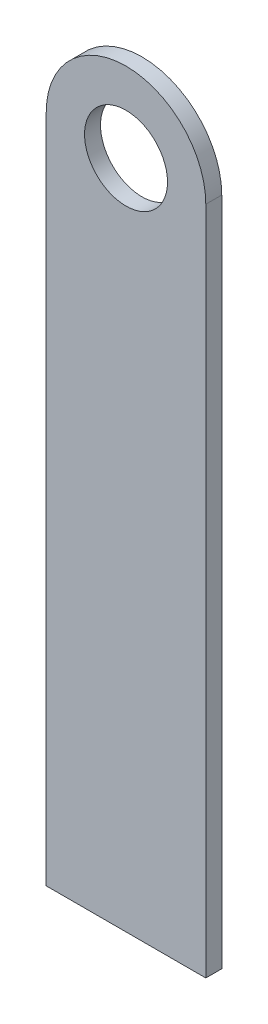
from build123d import *

# Parameters (mm, degrees)
SKETCH1_R           = 13
BOSS_EXTRUDE1_DEPTH = 5


with BuildPart() as part:
    # Sketch1 → Boss-Extrude1 (new body)
    with BuildSketch(Plane.XY):
        with BuildLine():
            Line((0, 0), (0, 210))
            ThreePointArc((0, 210), (25, 235), (50, 210))
            Line((50, 210), (50, 0))
            Line((50, 0), (0, 0))
        make_face()
        with Locations((25, 210)):
            Circle(SKETCH1_R, mode=Mode.SUBTRACT)
    extrude(amount=BOSS_EXTRUDE1_DEPTH)


solid = part.part
